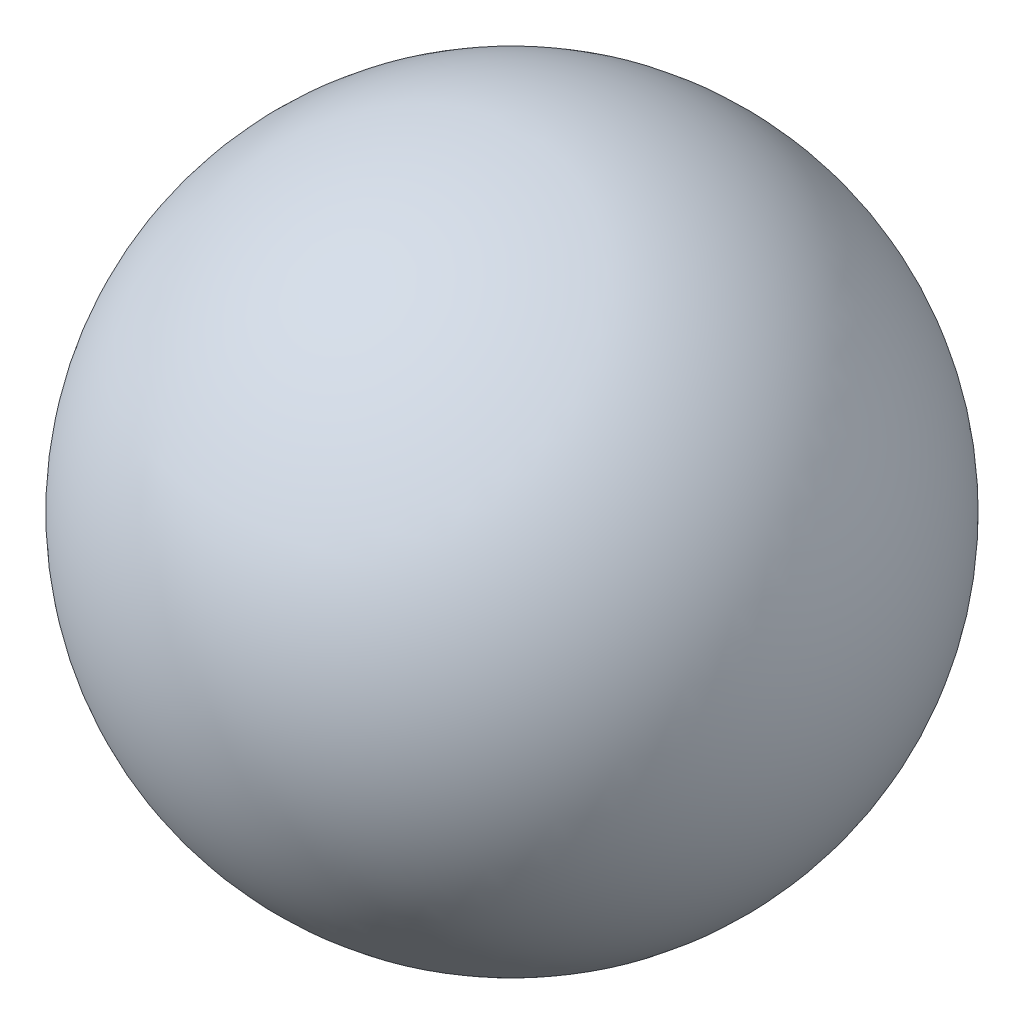
from build123d import *


with BuildPart() as part:
    # 草图1 → 旋转1 (revolve)
    with BuildSketch(Plane.XY):
        with BuildLine():
            Line((0, 0), (0, 240))
            ThreePointArc((0, 240), (-120, 120), (0, 0))
        make_face()
    revolve(axis=Axis((0, 0, 0), (0, 1, 0)))


solid = part.part
